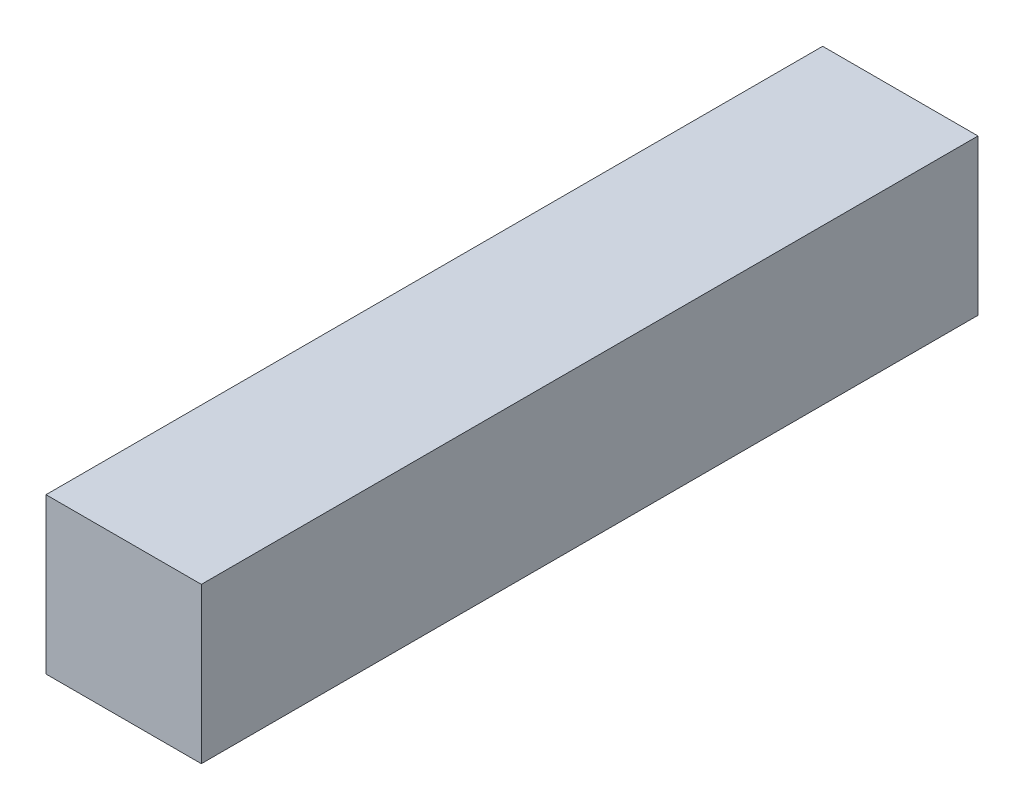
from build123d import *

# Parameters (mm, degrees)
SKETCH1_W           = 20
SKETCH1_H           = 20
BOSS_EXTRUDE1_DEPTH = 100


with BuildPart() as part:
    # Sketch1 → Boss-Extrude1 (new body)
    with BuildSketch(Plane.XY):
        Rectangle(SKETCH1_W, SKETCH1_H)
    extrude(amount=BOSS_EXTRUDE1_DEPTH)


solid = part.part
